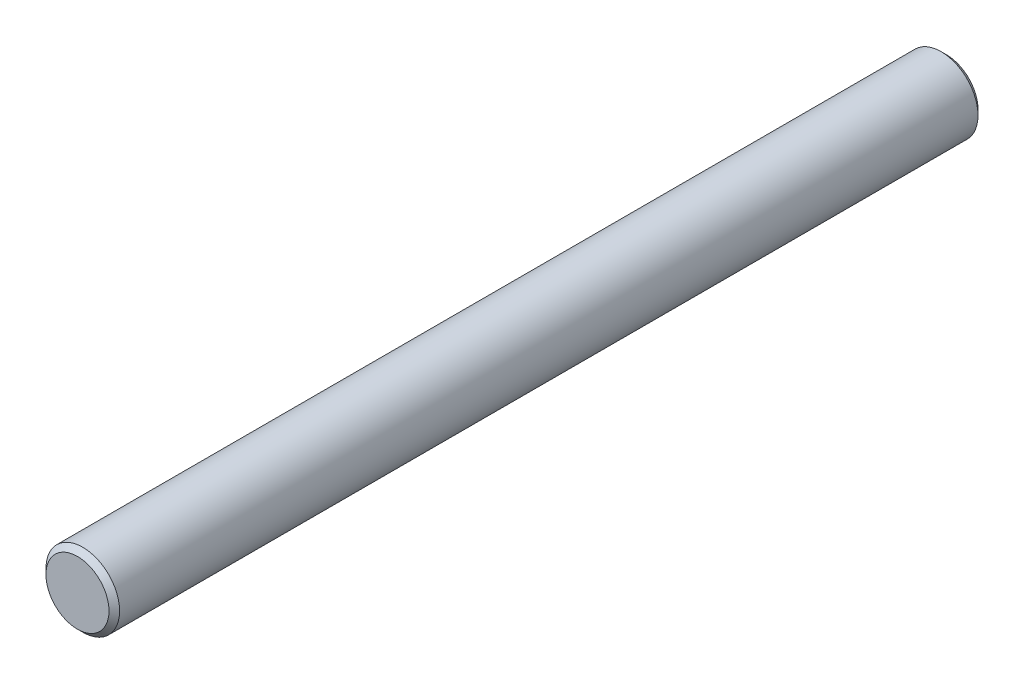
from build123d import *

# Parameters (mm, degrees)
SKETCH2_R           = 3.475
BOSS_EXTRUDE1_DEPTH = 41
CHAMFER1_SIZE       = 0.5


with BuildPart() as part:
    # Sketch2 → Boss-Extrude1 (new, symmetric)
    with BuildSketch(Plane.XY):
        Circle(SKETCH2_R)
    extrude(amount=BOSS_EXTRUDE1_DEPTH, both=True)

    # Chamfer1
    chamfer1_edges = [part.edges().sort_by_distance(p)[0] for p in [
        (-3.475, 0, -41),
        (-3.475, 0, 41),
    ]]
    chamfer(chamfer1_edges, length=CHAMFER1_SIZE)


solid = part.part
